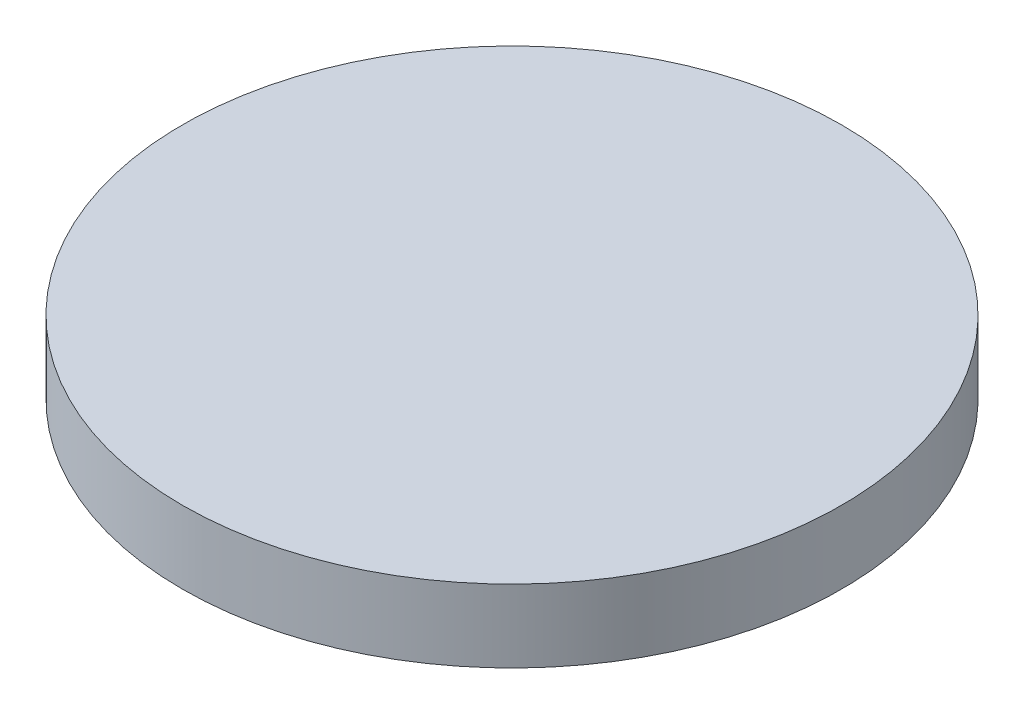
from build123d import *

# Parameters (mm, degrees)
SKETCH1_R           = 15.875
BOSS_EXTRUDE1_DEPTH = 3.499993


with BuildPart() as part:
    # Sketch1 → Boss-Extrude1 (new body)
    with BuildSketch(Plane(origin=(0, 0, 0), x_dir=(1, 0, 0), z_dir=(0, 1, 0))):
        with Locations(Location((0, 0, 0), (0, 0, 270))):
            Circle(SKETCH1_R)
    extrude(amount=BOSS_EXTRUDE1_DEPTH)


solid = part.part
